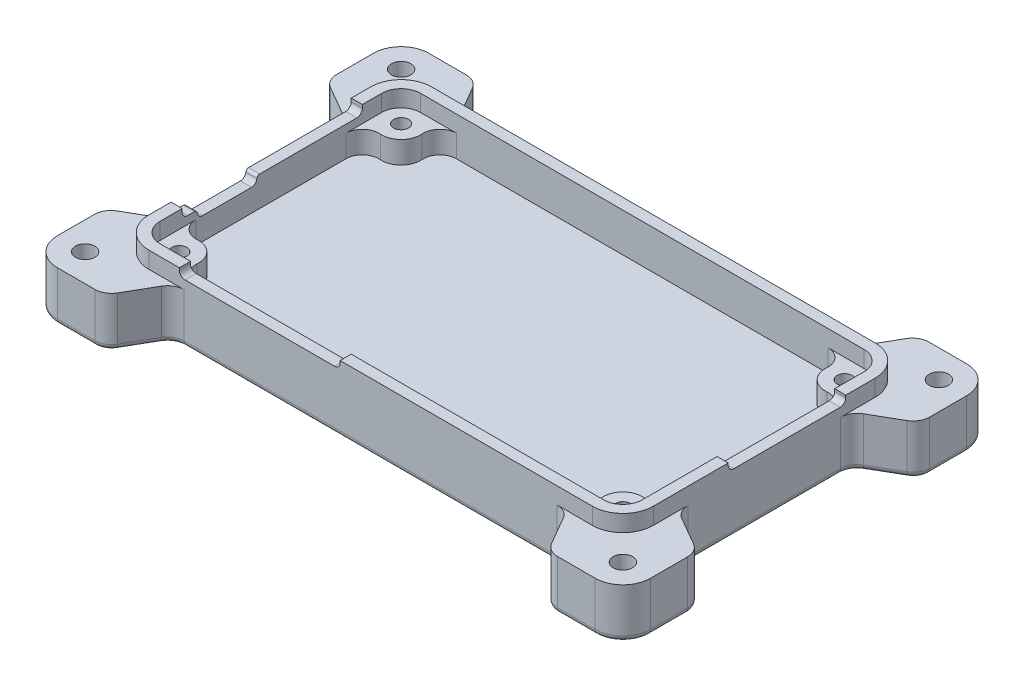
from build123d import *

# Parameters (mm, degrees)
SKETCH_1_R           = 1.35
EXTRUDE_1_DEPTH      = 5
SKETCH_2_R           = 1.35
EXTRUDE_2_DEPTH      = 4
EXTRUDE_3_DEPTH      = 3
CUT_EXTRUDE_4_DEPTH  = 3
CUT_EXTRUDE_5_DEPTH  = 3
CUT_EXTRUDE_6_DEPTH  = 3
CUT_EXTRUDE_9_DEPTH  = 64.761273513
FILLET_2_R           = 3
SKETCH_14_R          = 1.75
CUT_EXTRUDE_10_DEPTH = 64.761273513
FILLET_4_R           = 1
SKETCH_16_W          = 10.8
SKETCH_16_H          = 1.35
CUT_EXTRUDE_12_DEPTH = 2
FILLET_6_R           = 1
FILLET_7_R           = 0.5


with BuildPart() as part:
    # 草图1 → 凸台-拉伸1 (new body)
    with BuildSketch(Plane(origin=(0, 0, 0), x_dir=(1, 0, 0), z_dir=(0, 1, 0))):
        with BuildLine():
            Line((-48.5, 33.5), (48.5, 33.5))
            ThreePointArc((48.5, 33.5), (52.035533906, 32.035533906), (53.5, 28.5))
            Line((53.5, 28.5), (53.5, -28.5))
            ThreePointArc((53.5, -28.5), (52.035533906, -32.035533906), (48.5, -33.5))
            Line((48.5, -33.5), (-48.5, -33.5))
            ThreePointArc((-48.5, -33.5), (-52.035533906, -32.035533906), (-53.5, -28.5))
            Line((-53.5, -28.5), (-53.5, 28.5))
            ThreePointArc((-53.5, 28.5), (-52.035533906, 32.035533906), (-48.5, 33.5))
        make_face()
        with Locations(Location((-40, -20, 0), (0, 0, 270))):
            Circle(SKETCH_1_R, mode=Mode.SUBTRACT)
        with Locations(Location((-40, 20, 0), (0, 0, 270))):
            Circle(SKETCH_1_R, mode=Mode.SUBTRACT)
        with Locations(Location((40, 20, 0), (0, 0, 270))):
            Circle(SKETCH_1_R, mode=Mode.SUBTRACT)
        with Locations(Location((40, -20, 0), (0, 0, 270))):
            Circle(SKETCH_1_R, mode=Mode.SUBTRACT)
    extrude(amount=EXTRUDE_1_DEPTH)

    # 草图2 → 凸台-拉伸2 (add)
    with BuildSketch(Plane(origin=(0, 5, 0), x_dir=(1, 0, 0), z_dir=(0, 1, 0))):
        with BuildLine():
            Line((-53.5, 28.5), (-53.5, -28.5))
            ThreePointArc((-53.5, -28.5), (-52.035533906, -32.035533906), (-48.5, -33.5))
            Line((-48.5, -33.5), (48.5, -33.5))
            ThreePointArc((48.5, -33.5), (52.035533906, -32.035533906), (53.5, -28.5))
            Line((53.5, -28.5), (53.5, 28.5))
            ThreePointArc((53.5, 28.5), (52.035533906, 32.035533906), (48.5, 33.5))
            Line((48.5, 33.5), (-48.5, 33.5))
            ThreePointArc((-48.5, 33.5), (-52.035533906, 32.035533906), (-53.5, 28.5))
        make_face()
        with Locations(Location((40, -20, 0), (0, 0, 270))):
            Circle(SKETCH_2_R, mode=Mode.SUBTRACT)
        with Locations(Location((40, 20, 0), (0, 0, 270))):
            Circle(SKETCH_2_R, mode=Mode.SUBTRACT)
        with Locations(Location((-40, -20, 0), (0, 0, 270))):
            Circle(SKETCH_2_R, mode=Mode.SUBTRACT)
        with Locations(Location((-40, 20, 0), (0, 0, 270))):
            Circle(SKETCH_2_R, mode=Mode.SUBTRACT)
        with BuildLine():
            Line((-43.5, 13.519259302), (-43.5, -13.519259302))
            ThreePointArc((-43.5, -13.519259302), (-42.538098661, -15.720657459), (-40.269230769, -16.510370393))
            ThreePointArc((-40.269230769, -16.510370393), (-37.525126266, -17.525126266), (-36.510370393, -20.269230769))
            ThreePointArc((-36.510370393, -20.269230769), (-35.720657459, -22.538098661), (-33.519259302, -23.5))
            Line((-33.519259302, -23.5), (33.519259302, -23.5))
            ThreePointArc((33.519259302, -23.5), (35.720657459, -22.538098661), (36.510370393, -20.269230769))
            ThreePointArc((36.510370393, -20.269230769), (37.525126266, -17.525126266), (40.269230769, -16.510370393))
            ThreePointArc((40.269230769, -16.510370393), (42.538098661, -15.720657459), (43.5, -13.519259302))
            Line((43.5, -13.519259302), (43.5, 13.519259302))
            ThreePointArc((43.5, 13.519259302), (42.538098661, 15.720657459), (40.269230769, 16.510370393))
            ThreePointArc((40.269230769, 16.510370393), (37.525126266, 17.525126266), (36.510370393, 20.269230769))
            ThreePointArc((36.510370393, 20.269230769), (35.720657459, 22.538098661), (33.519259302, 23.5))
            Line((33.519259302, 23.5), (-33.519259302, 23.5))
            ThreePointArc((-33.519259302, 23.5), (-35.720657459, 22.538098661), (-36.510370393, 20.269230769))
            ThreePointArc((-36.510370393, 20.269230769), (-37.525126266, 17.525126266), (-40.269230769, 16.510370393))
            ThreePointArc((-40.269230769, 16.510370393), (-42.538098661, 15.720657459), (-43.5, 13.519259302))
        make_face(mode=Mode.SUBTRACT)
    extrude(amount=EXTRUDE_2_DEPTH)

    # 草图3 → 凸台-拉伸3 (add)
    with BuildSketch(Plane(origin=(0, 9, 0), x_dir=(1, 0, 0), z_dir=(0, 1, 0))):
        with BuildLine():
            Line((-40, -25.5), (40, -25.5))
            ThreePointArc((40, -25.5), (43.889087297, -23.889087297), (45.5, -20))
            Line((45.5, -20), (45.5, 20))
            ThreePointArc((45.5, 20), (43.889087297, 23.889087297), (40, 25.5))
            Line((40, 25.5), (-40, 25.5))
            ThreePointArc((-40, 25.5), (-43.889087297, 23.889087297), (-45.5, 20))
            Line((-45.5, 20), (-45.5, -20))
            ThreePointArc((-45.5, -20), (-43.889087297, -23.889087297), (-40, -25.5))
        make_face()
        with BuildLine():
            Line((43.5, -20), (43.5, 20))
            ThreePointArc((43.5, 20), (42.474873734, 22.474873734), (40, 23.5))
            Line((40, 23.5), (-40, 23.5))
            ThreePointArc((-40, 23.5), (-42.474873734, 22.474873734), (-43.5, 20))
            Line((-43.5, 20), (-43.5, -20))
            ThreePointArc((-43.5, -20), (-42.474873734, -22.474873734), (-40, -23.5))
            Line((-40, -23.5), (40, -23.5))
            ThreePointArc((40, -23.5), (42.474873734, -22.474873734), (43.5, -20))
        make_face(mode=Mode.SUBTRACT)
    extrude(amount=EXTRUDE_3_DEPTH)

    # 草图8 → 切除-拉伸4 (cut)
    with BuildSketch(Plane.ZY.offset(45.5)):
        with BuildLine():
            Line((-16.5, 12), (16, 12))
            Line((16, 12), (16, 11.4))
            ThreePointArc((16, 11.4), (15.707106781, 10.692893219), (15, 10.4))
            Line((15, 10.4), (-15.5, 10.4))
            ThreePointArc((-15.5, 10.4), (-16.207106781, 10.692893219), (-16.5, 11.4))
            Line((-16.5, 11.4), (-16.5, 12))
        make_face()
    extrude(amount=-CUT_EXTRUDE_4_DEPTH, mode=Mode.SUBTRACT)

    # 草图9 → 切除-拉伸5 (cut)
    with BuildSketch(Plane.XY.offset(25.5)):
        with BuildLine():
            Line((-34.5, 12), (-5.5, 12))
            Line((-5.5, 12), (-5.5, 11.6))
            ThreePointArc((-5.5, 11.6), (-5.792893219, 10.892893219), (-6.5, 10.6))
            Line((-6.5, 10.6), (-33.5, 10.6))
            ThreePointArc((-33.5, 10.6), (-34.207106781, 10.892893219), (-34.5, 11.6))
            Line((-34.5, 11.6), (-34.5, 12))
        make_face()
    extrude(amount=-CUT_EXTRUDE_5_DEPTH, mode=Mode.SUBTRACT)

    # 草图10 → 切除-拉伸6 (cut)
    with BuildSketch(Plane(origin=(45.5, 0, 0), x_dir=(0, 0, -1), z_dir=(1, 0, 0))):
        with BuildLine():
            Line((-6.5, 12), (14.7, 12))
            Line((14.7, 12), (14.7, 11.6))
            ThreePointArc((14.7, 11.6), (14.407106781, 10.892893219), (13.7, 10.6))
            Line((13.7, 10.6), (-5.5, 10.6))
            ThreePointArc((-5.5, 10.6), (-6.207106781, 10.892893219), (-6.5, 11.6))
            Line((-6.5, 11.6), (-6.5, 12))
        make_face()
    extrude(amount=-CUT_EXTRUDE_6_DEPTH, mode=Mode.SUBTRACT)

    # 草图13 → 切除-拉伸9 (cut, through all)
    with BuildSketch(Plane(origin=(0, 9, 0), x_dir=(1, 0, 0), z_dir=(0, 1, 0))):
        Polygon((-45.5, 15.5), (-45.5, -15.5), (-53.5, -20.118802154), (-53.5, 20.118802154), align=None)
        Polygon((53.5, 20.118802154), (45.5, 15.5), (45.5, -15.5), (53.5, -20.118802154), align=None)
        Polygon((-40, 33.5), (-35.381197846, 25.5), (35.381197846, 25.5), (40, 33.5), align=None)
        Polygon((35.381197846, -25.5), (40, -33.5), (-40, -33.5), (-35.381197846, -25.5), align=None)
    extrude(amount=-CUT_EXTRUDE_9_DEPTH, mode=Mode.SUBTRACT)

    # 圆角2
    fillet_2_edges = [part.edges().sort_by_distance(p)[0] for p in [
        (53.5, 4.5, -20.118802154),
        (53.5, 4.5, 20.118802154),
        (45.5, 4.5, 15.5),
        (45.5, 4.5, -15.5),
        (-45.5, 4.5, 15.5),
        (-53.5, 4.5, 20.118802154),
        (-53.5, 4.5, -20.118802154),
        (-45.5, 4.5, -15.5),
        (-40, 4.5, -33.5),
        (40, 4.5, -33.5),
        (35.381197846, 4.5, -25.5),
        (-35.381197846, 4.5, -25.5),
        (-35.381197846, 4.5, 25.5),
        (35.381197846, 4.5, 25.5),
        (40, 4.5, 33.5),
        (-40, 4.5, 33.5),
    ]]
    fillet(fillet_2_edges, radius=FILLET_2_R)

    # 草图14 → 切除-拉伸10 (cut, through all)
    with BuildSketch(Plane(origin=(0, 9, 0), x_dir=(1, 0, 0), z_dir=(0, 1, 0))):
        with Locations(Location((-48.5, 28.5, 0), (0, 0, 270))):
            Circle(SKETCH_14_R)
        with Locations(Location((-48.5, -28.5, 0), (0, 0, 270))):
            Circle(SKETCH_14_R)
        with Locations(Location((48.5, -28.5, 0), (0, 0, 90))):
            Circle(SKETCH_14_R)
        with Locations(Location((48.5, 28.5, 0), (0, 0, 90))):
            Circle(SKETCH_14_R)
    extrude(amount=-CUT_EXTRUDE_10_DEPTH, mode=Mode.SUBTRACT)

    # 圆角4
    fillet_4_edges = [part.edges().sort_by_distance(p)[0] for p in [
        (-45.116025404, 0, -33.5),
        (52.035533906, 0, -32.035533906),
        (53.5, 0, -25.175426481),
        (52.035533906, 0, 32.035533906),
        (-45.116025404, 0, 33.5),
        (-52.035533906, 0, 32.035533906),
        (-53.5, 0, -25.175426481),
        (-52.035533906, 0, -32.035533906),
        (37.690598923, 0, 29.5),
        (45.116025404, 0, 33.5),
        (45.5, 0, 0),
        (49.5, 0, 17.809401077),
        (53.5, 0, 25.175426481),
        (0, 0, 25.5),
        (-37.690598923, 0, 29.5),
        (-53.5, 0, 25.175426481),
        (-49.5, 0, 17.809401077),
        (-45.5, 0, 0),
        (-49.5, 0, -17.809401077),
        (-37.690598923, 0, -29.5),
        (0, 0, -25.5),
        (37.690598923, 0, -29.5),
        (45.116025404, 0, -33.5),
        (49.5, 0, -17.809401077),
        (-53.098076211, 0, -20.350852961),
        (53.098076211, 0, -20.350852961),
        (-53.098076211, 0, 20.350852961),
        (53.098076211, 0, 20.350852961),
        (-40.232050808, 0, -33.098076211),
        (40.232050808, 0, -33.098076211),
        (-40.232050808, 0, 33.098076211),
        (40.232050808, 0, 33.098076211),
        (35.149147039, 0, 25.901923789),
        (-35.149147039, 0, 25.901923789),
        (35.149147039, 0, -25.901923789),
        (-35.149147039, 0, -25.901923789),
        (45.901923789, 0, 15.267949192),
        (-45.901923789, 0, 15.267949192),
        (45.901923789, 0, -15.267949192),
        (-45.901923789, 0, -15.267949192),
    ]]
    fillet(fillet_4_edges, radius=FILLET_4_R)

    # 草图16 → 切除-拉伸12 (cut)
    with BuildSketch(Plane.ZY.offset(45.5)):
        with Locations((7.9, 9.725)):
            Rectangle(SKETCH_16_W, SKETCH_16_H)
    extrude(amount=-CUT_EXTRUDE_12_DEPTH, mode=Mode.SUBTRACT)

    # 圆角6
    fillet_6_edges = [part.edges().sort_by_distance(p)[0] for p in [
        (-44.5, 9.05, 13.3),
        (-44.5, 9.05, 2.5),
    ]]
    fillet(fillet_6_edges, radius=FILLET_6_R)

    # 圆角7
    fillet_7_edges = [part.edges().sort_by_distance(p)[0] for p in [
        (-44.5, 10.4, 2.5),
        (-44.5, 10.4, 13.3),
    ]]
    fillet(fillet_7_edges, radius=FILLET_7_R)


solid = part.part
